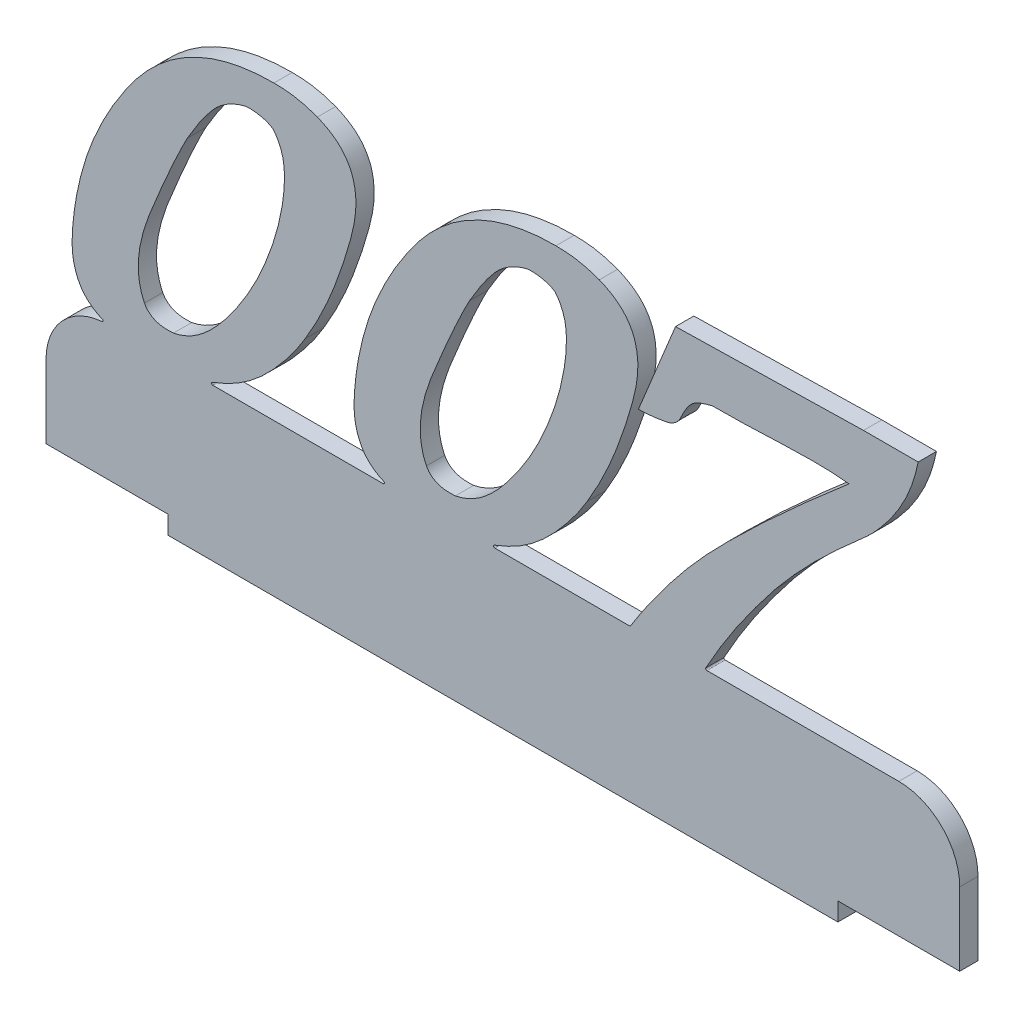
from build123d import *

# Parameters (mm, degrees)
BOSS_EXTRUDE1_DEPTH = 3
FILLET1_R           = 10
FILLET2_R           = 0.2


with BuildPart() as part:
    # Sketch1 → Boss-Extrude1 (new body)
    with BuildSketch(Plane.XY):
        with BuildLine():
            Line((108.156965084, 22), (150, 22))
            Line((150, 22), (150, 0))
            Line((150, 0), (130, 0))
            Line((130, 0), (130, -3))
            Line((130, -3), (20, -3))
            Line((20, -3), (20, 0))
            Line((20, 0), (0, 0))
            Line((0, 0), (0, 22))
            Line((0, 22), (10.273230585, 22))
            add(Edge.make_bspline(
                [(10.273230585, 22), (10.224853418, 22.014687932), (9.654789969, 22.189881445), (8.607355476, 22.558804124), (7.300970129, 23.408662326), (6.191007133, 24.427722872), (5.361133726, 25.704993719), (4.755651473, 27.17652392), (4.202027066, 29.541366101), (4.271659297, 31.461072676), (4.362001564, 32.775605942)],
                knots=[0.495744749, 0.495744749, 0.495744749, 0.495744749, 0.501387928, 0.562299825, 0.61931963, 0.674487907, 0.729675441, 0.788153341, 0.851799168, 1, 1, 1, 1], degree=3))
            add(Edge.make_bspline(
                [(4.362001564, 32.775605942), (4.52892563, 35.00370235), (5.0181185, 38.329275975), (6.147504973, 42.666080094), (7.210337368, 45.875443475), (8.56496081, 49.008780992), (10.102959035, 52.114610217), (11.910695564, 55.157759159), (13.91778064, 58.124893182), (16.115319076, 60.914241878), (18.589573882, 63.333055679), (21.231838316, 65.420687366), (24.11205857, 67.06807816), (27.147558566, 68.41591985), (31.569966243, 69.638248585), (35.048685099, 70.022962865), (37.4151681, 69.992181392)],
                knots=[0, 0, 0, 0, 0.122246067, 0.183381441, 0.245050885, 0.307031795, 0.37001055, 0.434578783, 0.500534692, 0.565957523, 0.628479512, 0.689453544, 0.749684058, 0.80955899, 0.870724503, 1, 1, 1, 1], degree=3))
            add(Edge.make_bspline(
                [(37.4151681, 69.992181392), (38.675407555, 69.981731538), (41.118246837, 69.838215607), (43.45840076, 69.128359812), (44.549648163, 68.721657545)],
                knots=[0, 0, 0, 0, 0.519885394, 1, 1, 1, 1], degree=3))
            add(Edge.make_bspline(
                [(44.549648163, 68.721657545), (45.817195576, 68.206359333), (47.612248234, 67.213009361), (49.351560901, 65.230097342), (50.261082993, 63.556623221), (50.776365575, 61.651704408), (50.941676549, 59.534659046), (50.748569112, 57.203890502), (49.999168847, 53.864482959), (48.7206485, 49.698054874), (46.41946489, 43.394475359), (44.222548707, 38.968197969), (42.555903049, 36.215793589)],
                knots=[0, 0, 0, 0, 0.111905612, 0.162582178, 0.212592743, 0.265416324, 0.321765959, 0.384451445, 0.45478123, 0.599580751, 0.738515281, 1, 1, 1, 1], degree=3))
            add(Edge.make_bspline(
                [(42.555903049, 36.215793589), (41.464418931, 34.358581305), (39.594121498, 31.788106819), (36.844770118, 28.665123709), (34.676075221, 26.595855876), (32.293643544, 24.788193419), (29.613919747, 23.292399311), (27.533271362, 22.446598084), (26.364579896, 22.052639141), (26.204144122, 22)],
                knots=[0, 0, 0, 0, 0.257859597, 0.380113614, 0.498337489, 0.61657684, 0.737567111, 0.865047578, 0.885269863, 0.885269863, 0.885269863, 0.885269863], degree=3))
            Line((26.204144122, 22), (56.559391648, 22))
            add(Edge.make_bspline(
                [(56.559391648, 22), (56.511014481, 22.014687932), (55.940951033, 22.189881445), (54.89351654, 22.558804124), (53.587131193, 23.408662326), (52.477168196, 24.427722872), (51.64729479, 25.704993719), (51.041812537, 27.17652392), (50.488188129, 29.541366101), (50.55782036, 31.461072676), (50.648162627, 32.775605942)],
                knots=[0.495744749, 0.495744749, 0.495744749, 0.495744749, 0.501387928, 0.562299825, 0.61931963, 0.674487907, 0.729675441, 0.788153341, 0.851799168, 1, 1, 1, 1], degree=3))
            add(Edge.make_bspline(
                [(50.648162627, 32.775605942), (50.815086693, 35.00370235), (51.304279563, 38.329275975), (52.433666036, 42.666080094), (53.496498431, 45.875443475), (54.851121874, 49.008780992), (56.389120098, 52.114610217), (58.196856627, 55.157759159), (60.203941703, 58.124893182), (62.401480139, 60.914241878), (64.875734945, 63.333055679), (67.517999379, 65.420687366), (70.398219634, 67.06807816), (73.433719629, 68.41591985), (77.856127306, 69.638248585), (81.334846162, 70.022962865), (83.701329163, 69.992181392)],
                knots=[0, 0, 0, 0, 0.122246067, 0.183381441, 0.245050885, 0.307031795, 0.37001055, 0.434578783, 0.500534692, 0.565957523, 0.628479512, 0.689453544, 0.749684058, 0.80955899, 0.870724503, 1, 1, 1, 1], degree=3))
            add(Edge.make_bspline(
                [(83.701329163, 69.992181392), (84.961568619, 69.981731538), (87.4044079, 69.838215607), (89.744561824, 69.128359812), (90.835809226, 68.721657545)],
                knots=[0, 0, 0, 0, 0.519885394, 1, 1, 1, 1], degree=3))
            add(Edge.make_bspline(
                [(90.835809226, 68.721657545), (92.10335664, 68.206359333), (93.898409298, 67.213009361), (95.637721964, 65.230097342), (96.547244056, 63.556623221), (97.062526638, 61.651704408), (97.227837613, 59.534659046), (97.034730175, 57.203890502), (96.28532991, 53.864482959), (95.006809563, 49.698054874), (92.705625953, 43.394475359), (90.50870977, 38.968197969), (88.842064113, 36.215793589)],
                knots=[0, 0, 0, 0, 0.111905612, 0.162582178, 0.212592743, 0.265416324, 0.321765959, 0.384451445, 0.45478123, 0.599580751, 0.738515281, 1, 1, 1, 1], degree=3))
            add(Edge.make_bspline(
                [(88.842064113, 36.215793589), (87.750579994, 34.358581305), (85.880282561, 31.788106819), (83.130931182, 28.665123709), (80.962236285, 26.595855876), (78.579804607, 24.788193419), (75.90008081, 23.292399311), (73.819432425, 22.446598084), (72.650740959, 22.052639141), (72.490305186, 22)],
                knots=[0, 0, 0, 0, 0.257859597, 0.380113614, 0.498337489, 0.61657684, 0.737567111, 0.865047578, 0.885269863, 0.885269863, 0.885269863, 0.885269863], degree=3))
            Line((72.490305186, 22), (95.908959814, 22))
            add(Edge.make_bspline(
                [(95.908959814, 22), (96.995671373, 23.754525783), (99.344615635, 27.311247283), (103.226340766, 32.497483971), (107.516630804, 37.568358159), (116.818997761, 47.08428797), (125.117702209, 54.454359356), (131.844409695, 60.218921032)],
                knots=[0.008091089, 0.008091089, 0.008091089, 0.008091089, 0.124627546, 0.248720924, 0.373780226, 0.49948977, 1, 1, 1, 1], degree=3))
            add(Edge.make_bspline(
                [(131.844409695, 60.218921032), (128.110811868, 60.600049763), (120.621389785, 60.430715367), (113.149543826, 60.039853605), (109.405003909, 60.082095387)],
                knots=[0, 0, 0, 0, 0.500071987, 1, 1, 1, 1], degree=3))
            add(Edge.make_bspline(
                [(109.405003909, 60.082095387), (108.728664455, 59.90496912), (107.531876619, 59.616576865), (106.444566912, 59.030433209), (106.043002346, 58.694292416)],
                knots=[0, 0, 0, 0, 0.573607643, 1, 1, 1, 1], degree=3))
            add(Edge.make_bspline(
                [(106.043002346, 58.694292416), (105.243026226, 57.915634886), (104.622848983, 56.705834067), (103.918359151, 55.242171227), (103.156583734, 54.4730453), (102.409344098, 54.142235153), (101.879593432, 54.022673964)],
                knots=[0, 0, 0, 0, 0.50642466, 0.630848312, 0.748367689, 1, 1, 1, 1], degree=3))
            add(Edge.make_bspline(
                [(101.879593432, 54.022673964), (100.940782829, 53.84153554), (99.407695274, 53.631972679), (97.860956705, 53.498835242), (97.266614543, 53.553557467)],
                knots=[0, 0, 0, 0, 0.616483644, 1, 1, 1, 1], degree=3))
            Line((97.266614543, 53.553557467), (103.345582486, 68.330727131))
            Line((103.345582486, 68.330727131), (134.209538702, 68.995308835))
            Line((134.209538702, 68.995308835), (143.181391712, 68.995308835))
            add(Edge.make_bspline(
                [(143.181391712, 68.995308835), (142.872242532, 67.494462455), (142.259378232, 65.262164908), (141.001542141, 62.445365636), (139.859688565, 60.4115959), (138.544922612, 58.434257998), (137.005948655, 56.551324843), (135.313043488, 54.69051916), (132.749805563, 52.417912942), (129.568736787, 49.633114822), (124.950232717, 45.154975201), (121.766238352, 41.680809296), (119.823299453, 39.304143862)],
                knots=[0, 0, 0, 0, 0.119748724, 0.179879688, 0.240465253, 0.301707379, 0.365035822, 0.430201538, 0.497898121, 0.63230209, 0.760395776, 1, 1, 1, 1], degree=3))
            add(Edge.make_bspline(
                [(119.823299453, 39.304143862), (117.543086172, 36.439295597), (114.288675116, 32.110768166), (110.544898967, 26.233528666), (108.901684331, 23.367137119), (108.156965084, 22)],
                knots=[0, 0, 0, 0, 0.515557004, 0.761333715, 0.980469969, 0.980469969, 0.980469969, 0.980469969], degree=3))
        make_face()
        with BuildLine():
            add(Edge.make_bspline(
                [(37.278342455, 63.385457389), (36.677082489, 63.794974539), (35.211794183, 64.301118734), (33.673998143, 64.428413869), (32.860828772, 64.382329945)],
                knots=[0, 0, 0, 0, 0.469698931, 1, 1, 1, 1], degree=3))
            add(Edge.make_bspline(
                [(32.860828772, 64.382329945), (31.716127501, 64.141641443), (30.098088593, 63.464113137), (28.209701649, 62.086547389), (25.901794971, 59.508487114), (24.368097208, 57.056903066), (23.224394058, 55.078186083)],
                knots=[0, 0, 0, 0, 0.252589616, 0.375811021, 0.503770371, 1, 1, 1, 1], degree=3))
            add(Edge.make_bspline(
                [(23.224394058, 55.078186083), (22.768115242, 54.280130329), (22.169895428, 52.963564703), (21.278382267, 51.144502344), (20.564914606, 49.562954394), (19.800533082, 47.84372591), (19.000045778, 45.976997066), (18.143446979, 43.980788964), (17.271382962, 41.892467256), (16.47839447, 39.794291262), (15.846738762, 37.766938076), (15.405933222, 35.859844371), (15.163031737, 34.066800528), (15.115717909, 32.387515998), (15.31742208, 30.361816791), (15.736930086, 28.938159439), (16.168100078, 28.08444097)],
                knots=[0, 0, 0, 0, 0.095871325, 0.150956838, 0.211549603, 0.277044413, 0.347448488, 0.423659813, 0.503898773, 0.583776288, 0.6578152, 0.725493304, 0.78794858, 0.846481479, 0.900510454, 1, 1, 1, 1], degree=3))
            add(Edge.make_bspline(
                [(16.168100078, 28.08444097), (16.52654692, 27.341423951), (18.026020976, 26.134148469), (19.938922022, 26.117560218), (20.917904613, 26.18842846)],
                knots=[0, 0, 0, 0, 0.446153942, 1, 1, 1, 1], degree=3))
            add(Edge.make_bspline(
                [(20.917904613, 26.18842846), (22.375429111, 26.462783668), (24.532024379, 27.481204233), (27.064325897, 29.648973765), (29.014787846, 31.806166343), (30.881586885, 34.291685515), (32.643112651, 36.965687311), (34.233560789, 39.79217391), (35.628088708, 42.74842191), (36.826238876, 45.765406369), (37.817773855, 48.777468218), (38.536455744, 51.765965073), (39.040992953, 54.65656842), (39.210609772, 57.358323676), (39.008743638, 60.388886842), (38.133897026, 62.377438305), (37.278342455, 63.385457389)],
                knots=[0, 0, 0, 0, 0.099522769, 0.157975555, 0.224341199, 0.295661745, 0.367825167, 0.440561069, 0.514605516, 0.588508481, 0.659789613, 0.728660389, 0.796041852, 0.857776262, 0.9112652, 1, 1, 1, 1], degree=3))
        make_face(mode=Mode.SUBTRACT)
        with BuildLine():
            add(Edge.make_bspline(
                [(83.564503518, 63.385457389), (82.963243552, 63.794974539), (81.497955246, 64.301118734), (79.960159206, 64.428413869), (79.146989836, 64.382329945)],
                knots=[0, 0, 0, 0, 0.469698931, 1, 1, 1, 1], degree=3))
            add(Edge.make_bspline(
                [(79.146989836, 64.382329945), (78.002288564, 64.141641443), (76.384249656, 63.464113137), (74.495862712, 62.086547389), (72.187956034, 59.508487114), (70.654258271, 57.056903066), (69.510555121, 55.078186083)],
                knots=[0, 0, 0, 0, 0.252589616, 0.375811021, 0.503770371, 1, 1, 1, 1], degree=3))
            add(Edge.make_bspline(
                [(69.510555121, 55.078186083), (69.054276306, 54.280130329), (68.456056492, 52.963564703), (67.56454333, 51.144502344), (66.851075669, 49.562954394), (66.086694145, 47.84372591), (65.286206841, 45.976997066), (64.429608042, 43.980788964), (63.557544025, 41.892467256), (62.764555533, 39.794291262), (62.132899826, 37.766938076), (61.692094285, 35.859844371), (61.4491928, 34.066800528), (61.401878972, 32.387515998), (61.603583143, 30.361816791), (62.023091149, 28.938159439), (62.454261142, 28.08444097)],
                knots=[0, 0, 0, 0, 0.095871325, 0.150956838, 0.211549603, 0.277044413, 0.347448488, 0.423659813, 0.503898773, 0.583776288, 0.6578152, 0.725493304, 0.78794858, 0.846481479, 0.900510454, 1, 1, 1, 1], degree=3))
            add(Edge.make_bspline(
                [(62.454261142, 28.08444097), (62.812707983, 27.341423951), (64.312182039, 26.134148469), (66.225083086, 26.117560218), (67.204065676, 26.18842846)],
                knots=[0, 0, 0, 0, 0.446153942, 1, 1, 1, 1], degree=3))
            add(Edge.make_bspline(
                [(67.204065676, 26.18842846), (68.661590174, 26.462783668), (70.818185443, 27.481204233), (73.35048696, 29.648973765), (75.30094891, 31.806166343), (77.167747948, 34.291685515), (78.929273715, 36.965687311), (80.519721852, 39.79217391), (81.914249771, 42.74842191), (83.112399939, 45.765406369), (84.103934918, 48.777468218), (84.822616808, 51.765965073), (85.327154016, 54.65656842), (85.496770836, 57.358323676), (85.294904701, 60.388886842), (84.42005809, 62.377438305), (83.564503518, 63.385457389)],
                knots=[0, 0, 0, 0, 0.099522769, 0.157975555, 0.224341199, 0.295661745, 0.367825167, 0.440561069, 0.514605516, 0.588508481, 0.659789613, 0.728660389, 0.796041852, 0.857776262, 0.9112652, 1, 1, 1, 1], degree=3))
        make_face(mode=Mode.SUBTRACT)
    extrude(amount=BOSS_EXTRUDE1_DEPTH)

    # Fillet1
    fillet1_edges = [part.edges().sort_by_distance(p)[0] for p in [
        (150, 22, 1.5),
        (0, 22, 1.5),
    ]]
    fillet(fillet1_edges, radius=FILLET1_R)

    # Fillet2
    fillet2_edges = [part.edges().sort_by_distance(p)[0] for p in [
        (95.908959814, 22, 1.5),
        (108.156965084, 22, 1.5),
        (72.490305186, 22, 1.5),
        (56.559391648, 22, 1.5),
        (26.204144122, 22, 1.5),
        (10.273230585, 22, 1.5),
    ]]
    fillet(fillet2_edges, radius=FILLET2_R)


solid = part.part
